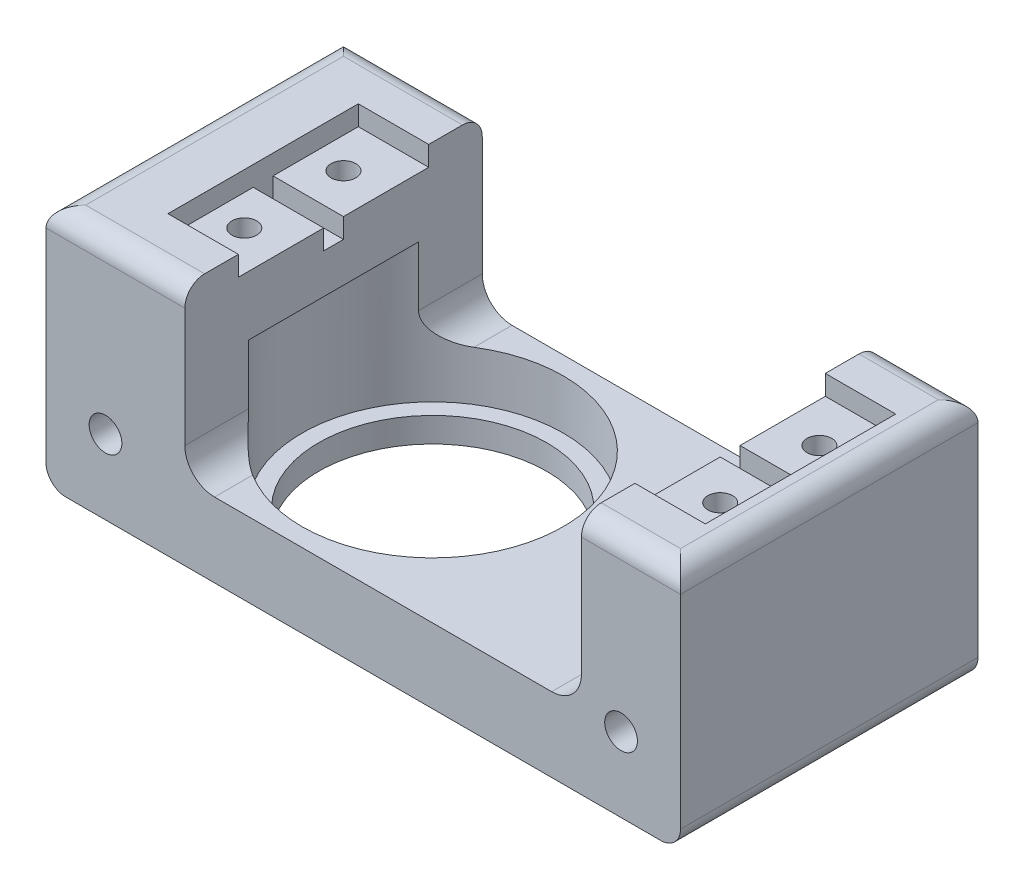
from build123d import *

# Parameters (mm, degrees)
SKETCH_1_W             = 64
SKETCH_1_H             = 30
EXTRUDE_555_DEPTH      = 7.5
SKETCH_2_R             = 13.175
CUT_EXTRUDE_693_DEPTH  = 5
SKETCH_4_R             = 11.5
CUT_EXTRUDE_912_DEPTH  = 44.011626335
EXTRUDE_START          = 3
SKETCH_8_W             = 64
SKETCH_8_H             = 30
SKETCH_8_R             = 13.175
EXTRUDE_1127_DEPTH     = 3
EXTRUDE_START_2        = 12
SKETCH_9_W             = 10
SKETCH_9_H             = 30
EXTRUDE_1452_DEPTH     = 12
SKETCH_10_R            = 1.25
CUT_EXTRUDE_1739_DEPTH = 11
SKETCH_11_R            = 1.65
CUT_EXTRUDE_2260_DEPTH = 55.829280499
SKETCH_12_W            = 10
SKETCH_12_H            = 5.4
EXTRUDE_2664_DEPTH     = 2
CUT_EXTRUDE_2902_DEPTH = 3
SKETCH_15_W            = 10
SKETCH_15_H            = 19.2
SKETCH_15_R            = 1.25
EXTRUDE_3173_DEPTH     = 9
CHAMFER_5_SIZE         = 3
SKETCH_17_W            = 2.9
SKETCH_17_H            = 19.2
EXTRUDE_3597_DEPTH     = 2
SKETCH_16_W            = 7.1
SKETCH_16_H            = 2
CUT_EXTRUDE_3878_DEPTH = 2
SKETCH_18_W            = 4
SKETCH_18_H            = 30
EXTRUDE_4043_DEPTH     = 14
FILLET_4_R             = 3
FILLET_5_R             = 2


with BuildPart() as part:
    # Эскиз1 → Extrude 555 (new body)
    with BuildSketch(Plane(origin=(0, 0, 0), x_dir=(1, 0, 0), z_dir=(0, 1, 0))):
        with Locations((8, 0)):
            Rectangle(SKETCH_1_W, SKETCH_1_H)
    extrude(amount=EXTRUDE_555_DEPTH)

    # Эскиз2 → Cut-Extrude 693 (cut)
    with BuildSketch(Plane(origin=(0, 7.5, 0), x_dir=(1, 0, 0), z_dir=(0, 1, 0))):
        with Locations(Location((0, 0, 0), (0, 0, 270))):
            Circle(SKETCH_2_R)
    extrude(amount=-CUT_EXTRUDE_693_DEPTH, mode=Mode.SUBTRACT)

    # Эскиз4 → Cut-Extrude 912 (cut, through all)
    with BuildSketch(Plane(origin=(0, 2.5, 0), x_dir=(1, 0, 0), z_dir=(0, 1, 0))):
        with Locations(Location((0, 0, 0), (0, 0, 270))):
            Circle(SKETCH_4_R)
    extrude(amount=-CUT_EXTRUDE_912_DEPTH, mode=Mode.SUBTRACT)

    # Эскиз8 → Extrude 1127 (add)
    with BuildSketch(Plane(origin=(0, 7.5, 0), x_dir=(1, 0, 0), z_dir=(0, 1, 0)).offset(EXTRUDE_START)):
        with Locations((8, 0)):
            Rectangle(SKETCH_8_W, SKETCH_8_H)
        with Locations(Location((0, 0, 0), (0, 0, 270))):
            Circle(SKETCH_8_R, mode=Mode.SUBTRACT)
    extrude(amount=-EXTRUDE_1127_DEPTH)

    # Эскиз9 → Extrude 1452 (add)
    with BuildSketch(Plane(origin=(0, 10.5, 0), x_dir=(1, 0, 0), z_dir=(0, 1, 0)).offset(EXTRUDE_START_2)):
        with BuildLine():
            Line((-20, 15), (-10, 15))
            Line((-10, 15), (-10, 8.577914956))
            ThreePointArc((-10, 8.577914956), (-13.175, 0), (-10, -8.577914956))
            Line((-10, -8.577914956), (-10, -15))
            Line((-10, -15), (-20, -15))
            Line((-20, -15), (-20, 15))
        make_face()
        with Locations((35, 0)):
            Rectangle(SKETCH_9_W, SKETCH_9_H)
    extrude(amount=-EXTRUDE_1452_DEPTH)

    # Эскиз10 → Cut-Extrude 1739 (cut)
    with BuildSketch(Plane(origin=(0, 22.5, 0), x_dir=(1, 0, 0), z_dir=(0, 1, 0))):
        with Locations(Location((-14, 5, 0), (0, 0, 270))):
            Circle(SKETCH_10_R)
        with Locations(Location((-14, -5, 0), (0, 0, 270))):
            Circle(SKETCH_10_R)
        with Locations(Location((34, -5, 0), (0, 0, 270))):
            Circle(SKETCH_10_R)
        with Locations(Location((34, 5, 0), (0, 0, 270))):
            Circle(SKETCH_10_R)
    extrude(amount=-CUT_EXTRUDE_1739_DEPTH, mode=Mode.SUBTRACT)

    # Эскиз11 → Cut-Extrude 2260 (cut, through all)
    with BuildSketch(Plane.XY.offset(15)):
        with Locations((-18, 7.5)):
            Circle(SKETCH_11_R)
        with Locations((34, 7.5)):
            Circle(SKETCH_11_R)
    extrude(amount=-CUT_EXTRUDE_2260_DEPTH, mode=Mode.SUBTRACT)

    # Эскиз12 → Extrude 2664 (add)
    with BuildSketch(Plane(origin=(0, 22.5, 0), x_dir=(1, 0, 0), z_dir=(0, 1, 0))):
        with Locations((-15, 12.3)):
            Rectangle(SKETCH_12_W, SKETCH_12_H)
        with Locations((-15, -12.3)):
            Rectangle(SKETCH_12_W, SKETCH_12_H)
        with Locations((35, -12.3)):
            Rectangle(SKETCH_12_W, SKETCH_12_H)
        with Locations((35, 12.3)):
            Rectangle(SKETCH_12_W, SKETCH_12_H)
    extrude(amount=EXTRUDE_2664_DEPTH)

    # Эскиз14 → Cut-Extrude 2902 (cut)
    with BuildSketch(Plane(origin=(0, 10.5, 0), x_dir=(1, 0, 0), z_dir=(0, 1, 0))):
        with BuildLine():
            Line((-10, 15), (-10, 8.577914956))
            ThreePointArc((-10, 8.577914956), (13.175, 0), (-10, -8.577914956))
            Line((-10, -8.577914956), (-10, -15))
            Line((-10, -15), (30, -15))
            Line((30, -15), (30, 15))
            Line((30, 15), (-10, 15))
        make_face()
    extrude(amount=-CUT_EXTRUDE_2902_DEPTH, mode=Mode.SUBTRACT)

    # Эскиз15 → Extrude 3173 (add)
    with BuildSketch(Plane(origin=(0, 22.5, 0), x_dir=(1, 0, 0), z_dir=(0, 1, 0))):
        with Locations((-15, 0)):
            Rectangle(SKETCH_15_W, SKETCH_15_H)
        with Locations(Location((-14, 5, 0), (0, 0, 270))):
            Circle(SKETCH_15_R, mode=Mode.SUBTRACT)
        with Locations(Location((-14, -5, 0), (0, 0, 270))):
            Circle(SKETCH_15_R, mode=Mode.SUBTRACT)
    extrude(amount=-EXTRUDE_3173_DEPTH)

    # Фаска5
    chamfer_5_edges = [part.edges().sort_by_distance(p)[0] for p in [
        (-10, 13.5, 0),
    ]]
    chamfer(chamfer_5_edges, length=CHAMFER_5_SIZE)

    # Эскиз17 → Extrude 3597 (add)
    with BuildSketch(Plane(origin=(0, 22.5, 0), x_dir=(1, 0, 0), z_dir=(0, 1, 0))):
        with Locations((-18.55, 0)):
            Rectangle(SKETCH_17_W, SKETCH_17_H)
        with Locations((38.55, 0)):
            Rectangle(SKETCH_17_W, SKETCH_17_H)
    extrude(amount=EXTRUDE_3597_DEPTH)

    # Эскиз16 → Cut-Extrude 3878 (cut)
    with BuildSketch(Plane(origin=(0, 22.5, 0), x_dir=(1, 0, 0), z_dir=(0, 1, 0))):
        with Locations((-13.55, 0)):
            Rectangle(SKETCH_16_W, SKETCH_16_H)
        with Locations((33.55, 0)):
            Rectangle(SKETCH_16_W, SKETCH_16_H)
    extrude(amount=-CUT_EXTRUDE_3878_DEPTH, mode=Mode.SUBTRACT)

    # Эскиз18 → Extrude 4043 (add)
    with BuildSketch(Plane(origin=(0, 10.5, 0), x_dir=(1, 0, 0), z_dir=(0, 1, 0))):
        with Locations((-22, 0)):
            Rectangle(SKETCH_18_W, SKETCH_18_H)
    extrude(amount=EXTRUDE_4043_DEPTH)

    # Скругление4
    fillet_4_edges = [part.edges().sort_by_distance(p)[0] for p in [
        (30, 7.5, 0),
        (-10, 7.5, 11.788957478),
        (-10, 7.5, -11.788957478),
    ]]
    fillet(fillet_4_edges, radius=FILLET_4_R)

    # Скругление5
    fillet_5_edges = [part.edges().sort_by_distance(p)[0] for p in [
        (-17, 24.5, 15),
        (40, 24.5, 0),
        (35, 24.5, 15),
        (35, 24.5, -15),
        (-24, 24.5, 0),
        (40, 0, 0),
        (-24, 0, 0),
        (-17, 24.5, -15),
    ]]
    fillet(fillet_5_edges, radius=FILLET_5_R)


solid = part.part
